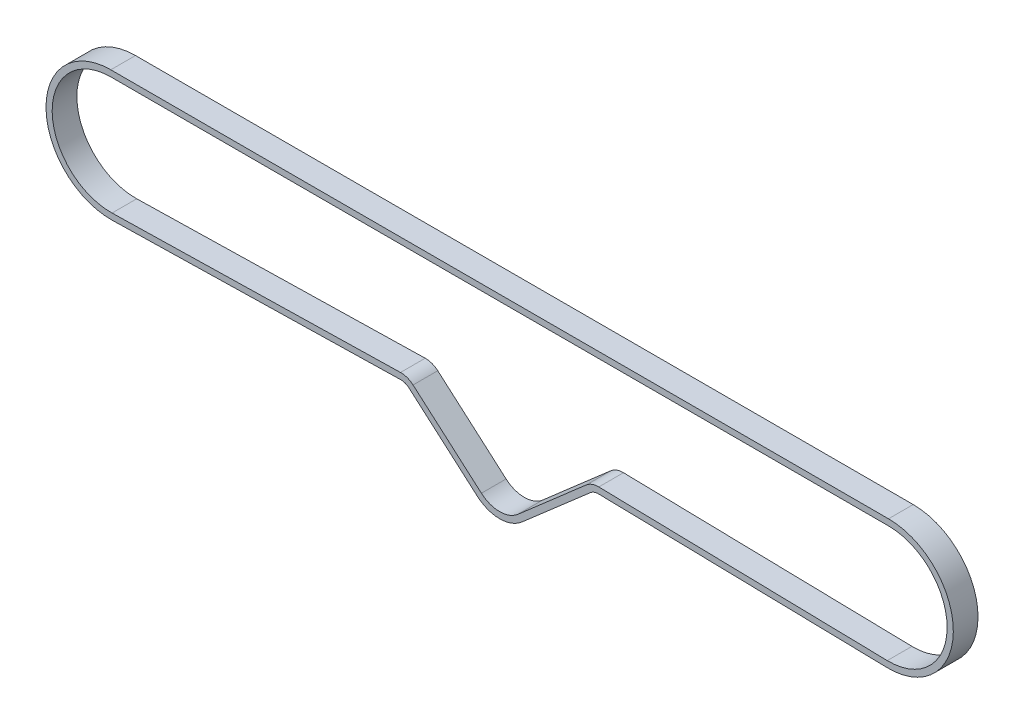
from build123d import *

# Parameters (mm, degrees)
EXTRUIR_L_MINA1_DEPTH = 20


with BuildPart() as part:
    # Croquis2 → Extruir-Lámina1 (new body)
    with BuildSketch(Plane.XY):
        with BuildLine():
            Line((-429.684186478, -78.209898266), (-374.32854171, -126.474819196))
            ThreePointArc((-374.32854171, -126.474819196), (-356.25601454, -133.247210514), (-338.183487369, -126.474819196))
            Line((-338.183487369, -126.474819196), (-282.827842602, -78.209898266))
            ThreePointArc((-282.827842602, -78.209898266), (-279.664968242, -76.346198087), (-276.042663992, -75.749486696))
            Line((-276.042663992, -75.749486696), (-42.376100513, -80.735910629))
            ThreePointArc((-42.376100513, -80.735910629), (11.241002289, -28.807937643), (-41.256010137, 24.252139416))
            Line((-41.256010137, 24.252139416), (-671.256009706, 24.252139416))
            ThreePointArc((-671.256009706, 24.252139416), (-723.753022133, -28.807937666), (-670.135919286, -80.735910628))
            Line((-670.135919286, -80.735910628), (-436.469365096, -75.749486696))
            ThreePointArc((-436.469365096, -75.749486696), (-432.847060841, -76.346198085), (-429.684186478, -78.209898266))
        make_face()
        with BuildLine():
            Line((-426.398272447, -74.441242142), (-371.042627679, -122.706163072))
            ThreePointArc((-371.042627679, -122.706163072), (-356.25601454, -128.247210514), (-341.4694014, -122.706163072))
            Line((-341.4694014, -122.706163072), (-286.113756633, -74.441242142))
            ThreePointArc((-286.113756633, -74.441242142), (-281.369445094, -71.645691873), (-275.935988718, -70.750624787))
            Line((-275.935988718, -70.750624787), (-42.269425239, -75.73704872))
            ThreePointArc((-42.269425239, -75.73704872), (6.24128682, -28.754596971), (-41.256010137, 19.252139416))
            Line((-41.256010137, 19.252139416), (-671.256009706, 19.252139416))
            ThreePointArc((-671.256009706, 19.252139416), (-718.753306663, -28.754596991), (-670.242594564, -75.737048719))
            Line((-670.242594564, -75.737048719), (-436.576040374, -70.750624787))
            ThreePointArc((-436.576040374, -70.750624787), (-431.142583991, -71.645691871), (-426.398272447, -74.441242142))
        make_face(mode=Mode.SUBTRACT)
    extrude(amount=-EXTRUIR_L_MINA1_DEPTH)


solid = part.part
